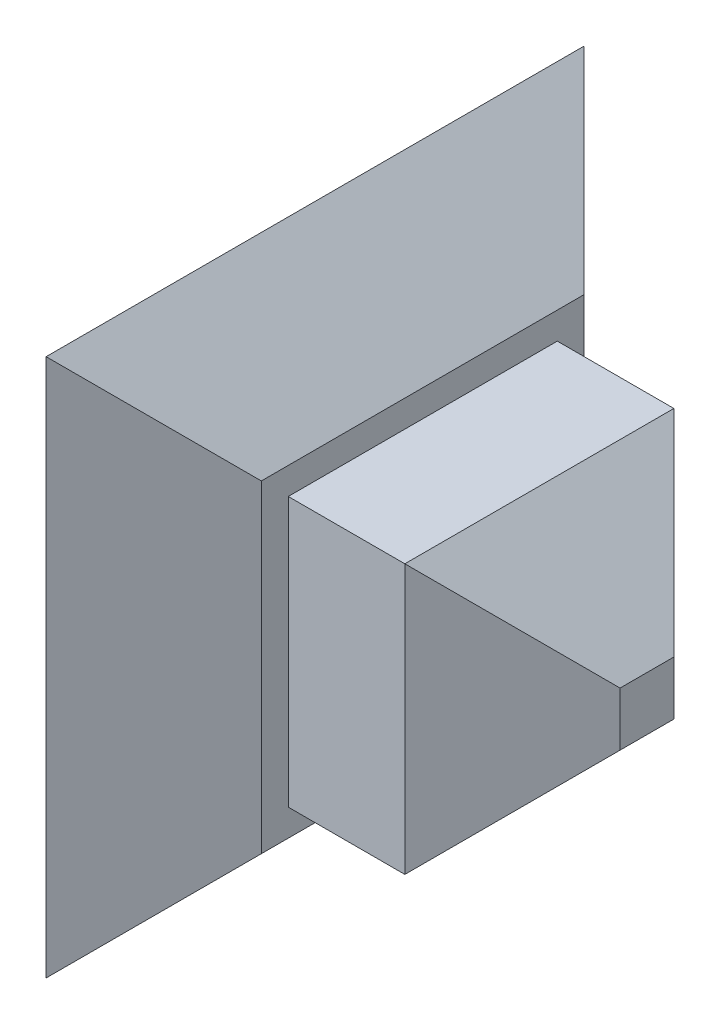
from build123d import *

# Parameters (mm, degrees)
SKETCH4_W                     = 38.1
SKETCH4_H                     = 38.1
BOSS_EXTRUDE2_DEPTH           = 15.24
BOSS_EXTRUDE2_TAPER           = 45
BOSS_EXTRUDE2_OTHER_WAY_DEPTH = 19.05
SKETCH10_W                    = 50.8
SKETCH10_H                    = 50.8
BOSS_EXTRUDE3_DEPTH           = 12.7
BOSS_EXTRUDE3_TAPER           = -45
BOSS_EXTRUDE3_OTHER_WAY_DEPTH = 2.54
BOSS_EXTRUDE3_OTHER_WAY_TAPER = 45


with BuildPart() as part:
    # Sketch4 → Boss-Extrude2 (new body)
    with BuildSketch(Plane(origin=(0, 0, 0), x_dir=(0, 0, -1), z_dir=(1, 0, 0))):
        Rectangle(SKETCH4_W, SKETCH4_H)
    extrude(amount=BOSS_EXTRUDE2_DEPTH, taper=BOSS_EXTRUDE2_TAPER)

    # Sketch4 → Boss-Extrude2 other way (add)
    with BuildSketch(Plane(origin=(0, 0, 0), x_dir=(0, 0, -1), z_dir=(1, 0, 0))):
        Rectangle(SKETCH4_W, SKETCH4_H)
    extrude(amount=-BOSS_EXTRUDE2_OTHER_WAY_DEPTH)

    # Sketch10 → Boss-Extrude3 (add)
    with BuildSketch(Plane.ZY.offset(19.05)):
        Rectangle(SKETCH10_W, SKETCH10_H)
    extrude(amount=BOSS_EXTRUDE3_DEPTH, taper=BOSS_EXTRUDE3_TAPER)

    # Sketch10 → Boss-Extrude3 other way (add)
    with BuildSketch(Plane.ZY.offset(19.05)):
        Rectangle(SKETCH10_W, SKETCH10_H)
    extrude(amount=-BOSS_EXTRUDE3_OTHER_WAY_DEPTH, taper=BOSS_EXTRUDE3_OTHER_WAY_TAPER)


solid = part.part
